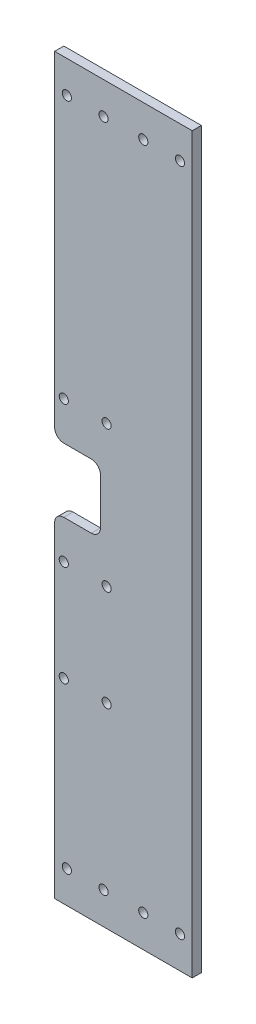
from build123d import *

# Parameters (mm, degrees)
MODEL_R             = 1.5
EXTRUDE_1_DEPTH     = 3
SKETCH_1_R          = 1.5
CUT_EXTRUDE_1_DEPTH = 10


with BuildPart() as part:
    # Model → 凸台-拉伸1 (new body)
    with BuildSketch(Plane.XY):
        with BuildLine():
            ThreePointArc((2779.510343176, 1861.218710153), (2781.63166352, 1860.340030496), (2782.510343176, 1858.218710153))
            Line((2782.510343176, 1858.218710153), (2782.510343176, 1843.218710153))
            ThreePointArc((2782.510343176, 1843.218710153), (2781.63166352, 1841.097389809), (2779.510343176, 1840.218710153))
            Line((2779.510343176, 1840.218710153), (2770.510343176, 1840.218710153))
            ThreePointArc((2770.510343176, 1840.218710153), (2768.389022832, 1839.340030496), (2767.510343176, 1837.218710153))
            Line((2767.510343176, 1837.218710153), (2767.510343176, 1744.718710153))
            Line((2767.510343176, 1744.718710153), (2767.510343176, 1730.718710153))
            Line((2767.510343176, 1730.718710153), (2787.510343176, 1730.718710153))
            Line((2787.510343176, 1730.718710153), (2792.510343176, 1730.718710153))
            Line((2792.510343176, 1730.718710153), (2812.510343176, 1730.718710153))
            Line((2812.510343176, 1730.718710153), (2812.510343176, 1732.218710153))
            Line((2812.510343176, 1732.218710153), (2812.510343176, 1737.218710153))
            Line((2812.510343176, 1737.218710153), (2812.510343176, 1744.718710153))
            Line((2812.510343176, 1744.718710153), (2812.510343176, 1970.718710153))
            Line((2812.510343176, 1970.718710153), (2767.510343176, 1970.718710153))
            Line((2767.510343176, 1970.718710153), (2767.510343176, 1864.218710153))
            ThreePointArc((2767.510343176, 1864.218710153), (2768.389022832, 1862.097389809), (2770.510343176, 1861.218710153))
            Line((2770.510343176, 1861.218710153), (2779.510343176, 1861.218710153))
        make_face()
        with Locations((2771.510343176, 1741.218710153)):
            Circle(MODEL_R, mode=Mode.SUBTRACT)
        with Locations((2783.510343176, 1741.218710153)):
            Circle(MODEL_R, mode=Mode.SUBTRACT)
        with Locations((2770.510343176, 1827.618710153)):
            Circle(MODEL_R, mode=Mode.SUBTRACT)
        with Locations((2784.510343176, 1827.618710153)):
            Circle(MODEL_R, mode=Mode.SUBTRACT)
        with Locations((2796.510343176, 1741.218710153)):
            Circle(MODEL_R, mode=Mode.SUBTRACT)
        with Locations((2808.510343176, 1741.218710153)):
            Circle(MODEL_R, mode=Mode.SUBTRACT)
        with Locations((2770.510343176, 1873.818710153)):
            Circle(MODEL_R, mode=Mode.SUBTRACT)
        with Locations((2784.510343176, 1873.818710153)):
            Circle(MODEL_R, mode=Mode.SUBTRACT)
        with Locations((2771.510343176, 1960.218710153)):
            Circle(MODEL_R, mode=Mode.SUBTRACT)
        with Locations((2783.510343176, 1960.218710153)):
            Circle(MODEL_R, mode=Mode.SUBTRACT)
        with Locations((2796.510343176, 1960.218710153)):
            Circle(MODEL_R, mode=Mode.SUBTRACT)
        with Locations((2808.510343176, 1960.218710153)):
            Circle(MODEL_R, mode=Mode.SUBTRACT)
    extrude(amount=EXTRUDE_1_DEPTH)

    # 草图1 → 切除-拉伸1 (cut)
    with BuildSketch(Plane.XY.offset(3)):
        with Locations((2770.510343176, 1794.618710153)):
            Circle(SKETCH_1_R)
        with Locations((2784.510343176, 1794.618710153)):
            Circle(SKETCH_1_R)
    extrude(amount=-CUT_EXTRUDE_1_DEPTH, mode=Mode.SUBTRACT)


solid = part.part
